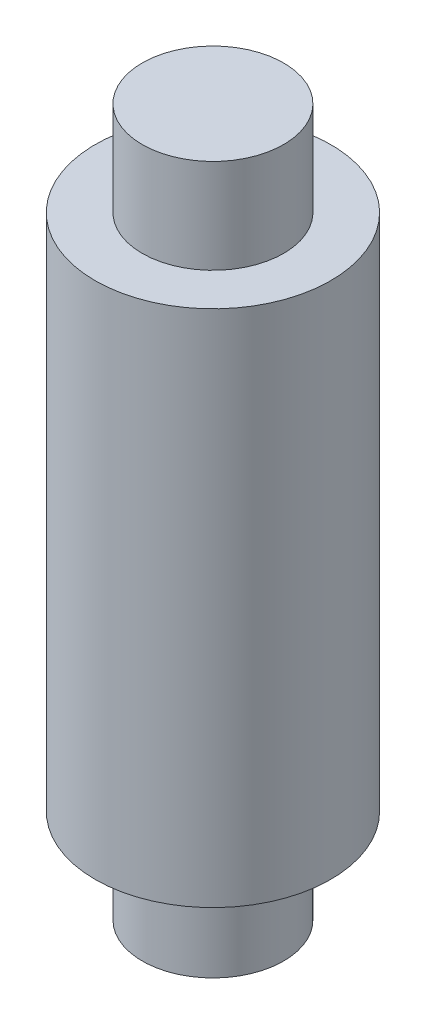
from build123d import *

# Parameters (mm, degrees)
SKETCH_1_R      = 2.5
EXTRUDE_1_DEPTH = 11
SKETCH_2_R      = 1.5
EXTRUDE_2_DEPTH = 2
EXTRUDE_START   = 2
SKETCH_4_R      = 1.5
EXTRUDE_3_DEPTH = 2


with BuildPart() as part:
    # Эскиз1 → Бобышка-Вытянуть1 (new body)
    with BuildSketch(Plane(origin=(0, 0, 0), x_dir=(1, 0, 0), z_dir=(0, 1, 0))):
        with Locations(Location((0, 0, 0), (0, 0, 270))):
            Circle(SKETCH_1_R)
    extrude(amount=EXTRUDE_1_DEPTH)

    # Эскиз2 → Бобышка-Вытянуть2 (add)
    with BuildSketch(Plane(origin=(0, 11, 0), x_dir=(1, 0, 0), z_dir=(0, 1, 0))):
        with Locations(Location((0, 0, 0), (0, 0, 270))):
            Circle(SKETCH_2_R)
    extrude(amount=EXTRUDE_2_DEPTH)

    # Эскиз4 → Бобышка-Вытянуть3 (add)
    with BuildSketch(Plane.XZ.offset(EXTRUDE_START)):
        with Locations(Location((0, 0, 0), (0, 0, 90))):
            Circle(SKETCH_4_R)
    extrude(amount=-EXTRUDE_3_DEPTH)


solid = part.part
